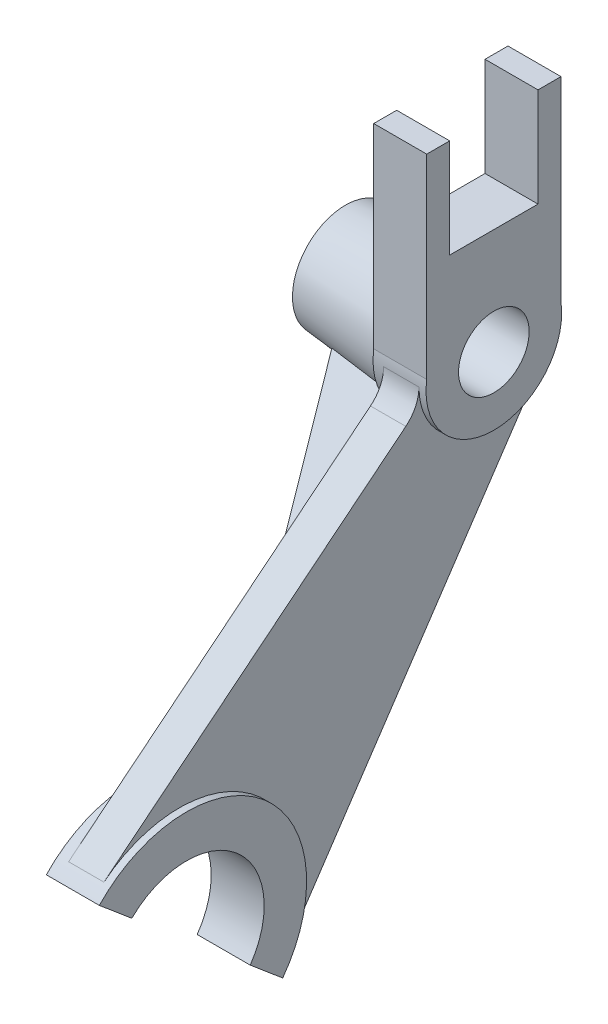
from build123d import *

# Parameters (mm, degrees)
SKETCH_4_W          = 38
SKETCH_4_H          = 58
EXTRUDE_1_DEPTH     = 15
EXTRUDE_START       = -2
EXTRUDE_2_DEPTH     = 10
EXTRUDE_3_DEPTH     = 15
SKETCH_8_R          = 19.2
EXTRUDE_4_DEPTH     = 15
RIB_4_REACH         = 173.764
SKETCH_7_WALL_W     = 417.368166338
SKETCH_7_WALL_H     = 10
RIB_4_DRAFT_ANGLE   = 0.1993373
SKETCH_9_R          = 10
CUT_EXTRUDE_1_DEPTH = 172.764033058
SKETCH_10_W         = 25
SKETCH_10_H         = 28
CUT_EXTRUDE_2_DEPTH = 169.724281158


with BuildPart() as part:
    # 草图4 → 凸台-拉伸1 (new body)
    with BuildSketch(Plane(origin=(0, 0, 0), x_dir=(0, 0, -1), z_dir=(1, 0, 0))):
        with Locations((0, 29)):
            Rectangle(SKETCH_4_W, SKETCH_4_H)
    extrude(amount=-EXTRUDE_1_DEPTH)

    # 草图2 → 旋转1 (revolve)
    with BuildSketch(Plane.XY):
        Polygon((-42, 0), (-42, 15), (0, 19.2), (0, 0), align=None)
    revolve(axis=Axis((-18.865866606, 0, 0), (1, 0, 0)))



with BuildPart() as body_2:
    # 草图5 → 凸台-拉伸2 (new body)
    with BuildSketch(Plane(origin=(0, 0, 0), x_dir=(0, 0, -1), z_dir=(1, 0, 0)).offset(EXTRUDE_START)):
        with BuildLine():
            Line((-111.66423124, -79.82543117), (-102.463778118, -87.579530564))
            ThreePointArc((-102.463778118, -87.579530564), (-72.822222222, -86.405578238), (-68.958444104, -115.817671306))
            Line((-68.958444104, -115.817671306), (-59.757990982, -123.5717707))
            Line((-59.757990982, -123.5717707), (-58.756458022, -122.156778939))
            Line((-58.756458022, -122.156778939), (15.949294293, -10.689247473))
            ThreePointArc((15.949294293, -10.689247473), (-5.586302425, -18.369355602), (-19.2, 0))
            ThreePointArc((-19.2, 0), (-20.177119331, -4.311336735), (-22.917524888, -7.780135376))
            Line((-22.917524888, -7.780135376), (-108.360415381, -76.775442927))
            Line((-108.360415381, -76.775442927), (-111.66423124, -79.82543117))
        make_face()
    extrude(amount=-EXTRUDE_2_DEPTH)

    # 草图6 → 凸台-拉伸3 (add)
    with BuildSketch(Plane(origin=(0, 0, 0), x_dir=(0, 0, -1), z_dir=(1, 0, 0))):
        with BuildLine():
            Line((-111.66423124, -79.82543117), (-102.463778118, -87.579530564))
            ThreePointArc((-102.463778118, -87.579530564), (-72.822222222, -86.405578238), (-68.958444104, -115.817671306))
            Line((-68.958444104, -115.817671306), (-59.757990982, -123.5717707))
            ThreePointArc((-59.757990982, -123.5717707), (-65.088888889, -77.22976462), (-111.66423124, -79.82543117))
        make_face()
    extrude(amount=-EXTRUDE_3_DEPTH)


with BuildPart() as part_1:
    add(part.part)

    add(body_2.part)  # 凸台-拉伸4 merges body 2
    # 草图8 → 凸台-拉伸4 (add)
    with BuildSketch(Plane(origin=(0, 0, 0), x_dir=(0, 0, -1), z_dir=(1, 0, 0))):
        Circle(SKETCH_8_R)
    extrude(amount=-EXTRUDE_4_DEPTH)

    # 草图7 wall → 筋4 (add, up to next)
    with BuildSketch(Plane(origin=(-22, -38.61488231, 32.544444445), x_dir=(0.278396048141, -0.734421696805, 0.618967213705), z_dir=(0.960466366084, 0.212875854148, -0.17941078658)), mode=Mode.PRIVATE) as rib_4_sk1:
        Rectangle(SKETCH_7_WALL_W, SKETCH_7_WALL_H)
    rib_4_tool1 = extrude(rib_4_sk1.sketch, amount=RIB_4_REACH, mode=Mode.PRIVATE) - part_1.part
    add(rib_4_tool1.solids().sort_by_distance((-22, -38.61488231, 32.544444445))[0])

    # 筋4 draft
    rib_4_draft_faces = [part_1.faces().sort_by_distance(p)[0] for p in [
        (-21.519766817, -41.730666605, 28.631483377),
        (-21.519766817, -35.286222161, 36.277994725),
    ]]
    draft(rib_4_draft_faces, Plane(origin=(-22, -38.61488231, 32.544444445), x_dir=(0.278396048141, -0.734421696805, 0.618967213705), z_dir=(-0.960466366084, -0.212875854148, 0.17941078658)), RIB_4_DRAFT_ANGLE)

    # 草图9 → 切除-拉伸1 (cut, through all)
    with BuildSketch(Plane.ZY.offset(42)):
        Circle(SKETCH_9_R)
    extrude(amount=-CUT_EXTRUDE_1_DEPTH, mode=Mode.SUBTRACT)

    # 草图10 → 切除-拉伸2 (cut, through all)
    with BuildSketch(Plane.ZY.offset(15)):
        with Locations((0, 44)):
            Rectangle(SKETCH_10_W, SKETCH_10_H)
    extrude(amount=-CUT_EXTRUDE_2_DEPTH, mode=Mode.SUBTRACT)


solid = part_1.part
